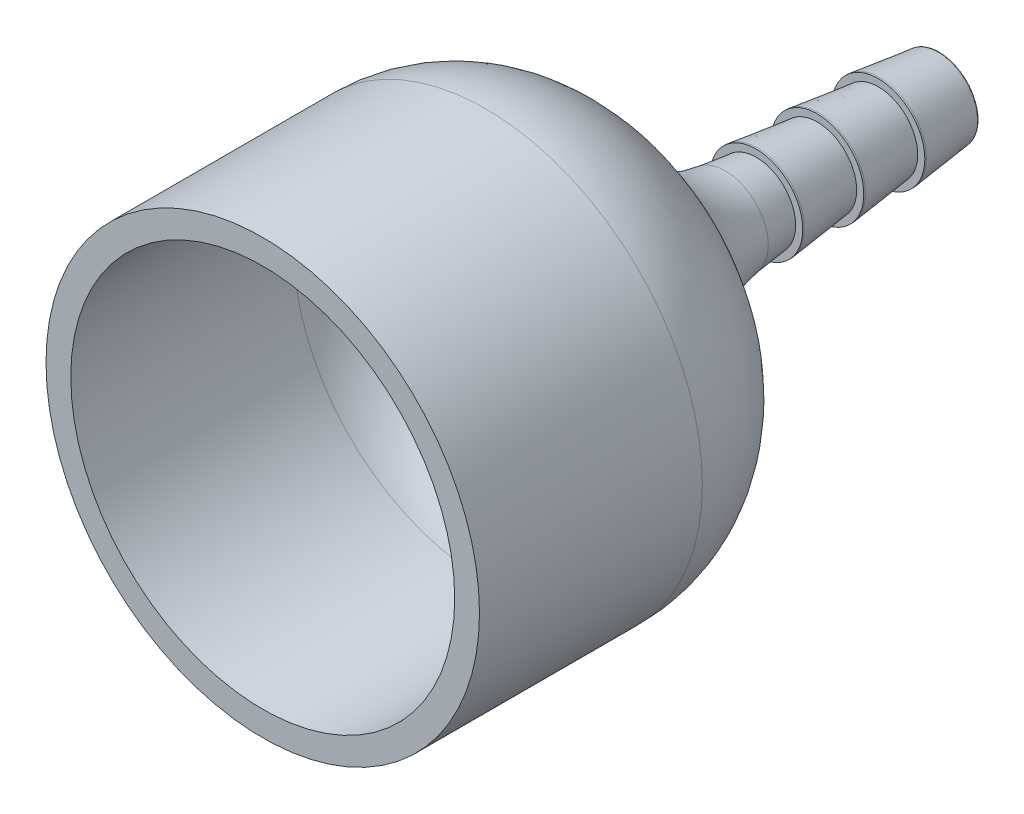
from build123d import *

# Parameters (mm, degrees)
FILLET1_R = 10
FILLET2_R = 1


with BuildPart() as part:
    # Sketch1 → Revolve1 (revolve)
    with BuildSketch(Plane(origin=(0, 0, 0), x_dir=(1, 0, 0), z_dir=(0, 1, 0))):
        with BuildLine():
            Line((4.350194802, 0.893), (3.17642875, 10.7482))
            Line((3.17642875, 10.7482), (3.748185925, 10.7482))
            Line((3.748185925, 10.7482), (3.748185925, 10.8752))
            Line((3.748185925, 10.8752), (3.17642875, 15.6758))
            Line((3.17642875, 15.6758), (3.748185925, 15.6758))
            Line((3.748185925, 15.6758), (3.748185925, 15.8028))
            Line((3.748185925, 15.8028), (3.17642875, 20.6034))
            Line((3.17642875, 20.6034), (3.748185925, 20.6034))
            Line((3.748185925, 20.6034), (3.748185925, 20.7304))
            Line((3.748185925, 20.7304), (3.189766531, 25.419013037))
            add(Edge.make_bspline(
                [(3.189766531, 25.419013037), (3.186366459, 25.447560793), (3.171391458, 25.478531163), (3.122909051, 25.520829006), (3.091096062, 25.531), (3.063600271, 25.531)],
                knots=[0, 0, 0, 0, 0.5, 0.5, 1, 1, 1, 1], degree=3))
            Line((3.063600271, 25.531), (2.248911555, 25.531))
            Line((2.248911555, 25.531), (2.248911555, -1.107))
            Line((2.248911555, -1.107), (5.5, -1.107))
            ThreePointArc((5.5, -1.107), (12.571067812, -4.035932188), (15.5, -11.107))
            Line((15.5, -11.107), (15.5, -29.102833044))
            Line((15.5, -29.102833044), (17.5, -29.102833044))
            Line((17.5, -29.102833044), (17.5, -11.107))
            ThreePointArc((17.5, -11.107), (13.985281374, -2.621718626), (5.5, 0.893))
            Line((5.5, 0.893), (4.350194802, 0.893))
        make_face()
    revolve(axis=Axis((0, 0, -25.781), (0, 0, 1)))

    # Fillet1
    fillet1_edges = [part.edges().sort_by_distance(p)[0] for p in [
        (-4.350194802, 0, -0.893),
    ]]
    fillet(fillet1_edges, radius=FILLET1_R)

    # Fillet2
    fillet2_edges = [part.edges().sort_by_distance(p)[0] for p in [
        (-2.248911555, 0, 1.107),
    ]]
    fillet(fillet2_edges, radius=FILLET2_R)


solid = part.part
